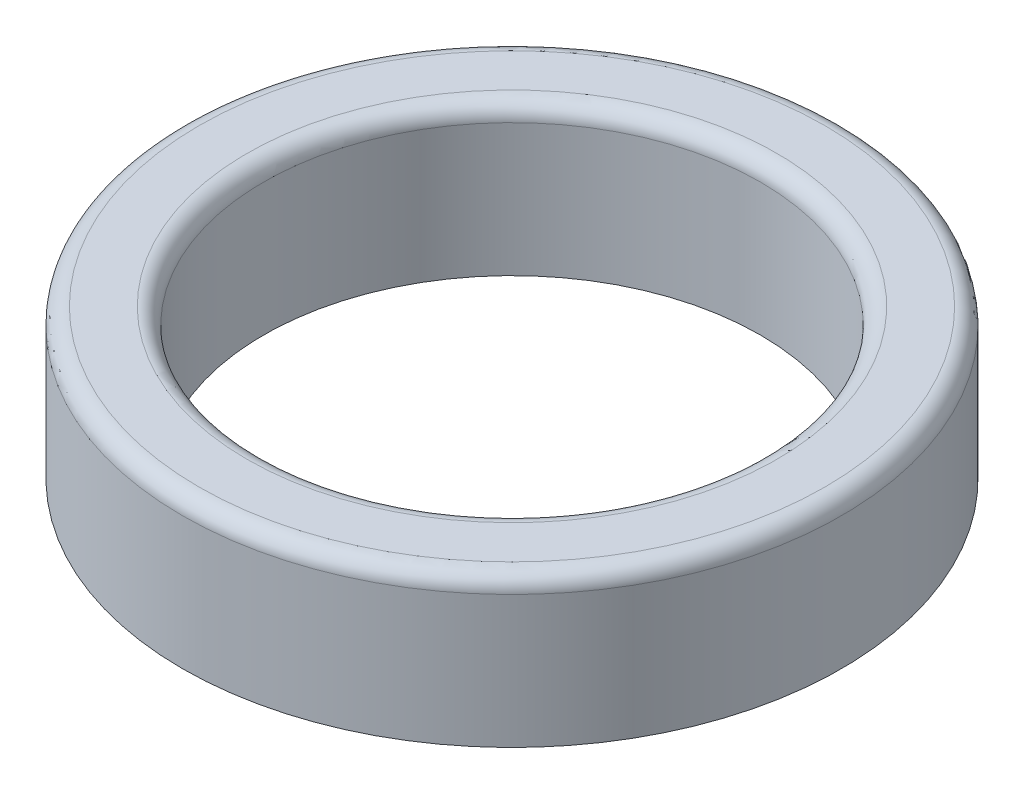
from build123d import *

# Parameters (mm, degrees)
SKETCH1_R           = 19.9
SKETCH1_R_2         = 15
BOSS_EXTRUDE2_DEPTH = 9
FILLET1_R           = 1


with BuildPart() as part:
    # Sketch1 → Boss-Extrude2 (new body)
    with BuildSketch(Plane(origin=(0, 0, 0), x_dir=(1, 0, 0), z_dir=(0, 1, 0))):
        with Locations(Location((0, 0, 0), (0, 0, 270))):
            Circle(SKETCH1_R)
        with Locations(Location((0, 0, 0), (0, 0, 270))):
            Circle(SKETCH1_R_2, mode=Mode.SUBTRACT)
    extrude(amount=BOSS_EXTRUDE2_DEPTH)

    # Fillet1
    fillet1_edges = [part.edges().sort_by_distance(p)[0] for p in [
        (0, 9, -19.9),
        (0, 9, -15),
    ]]
    fillet(fillet1_edges, radius=FILLET1_R)


solid = part.part
